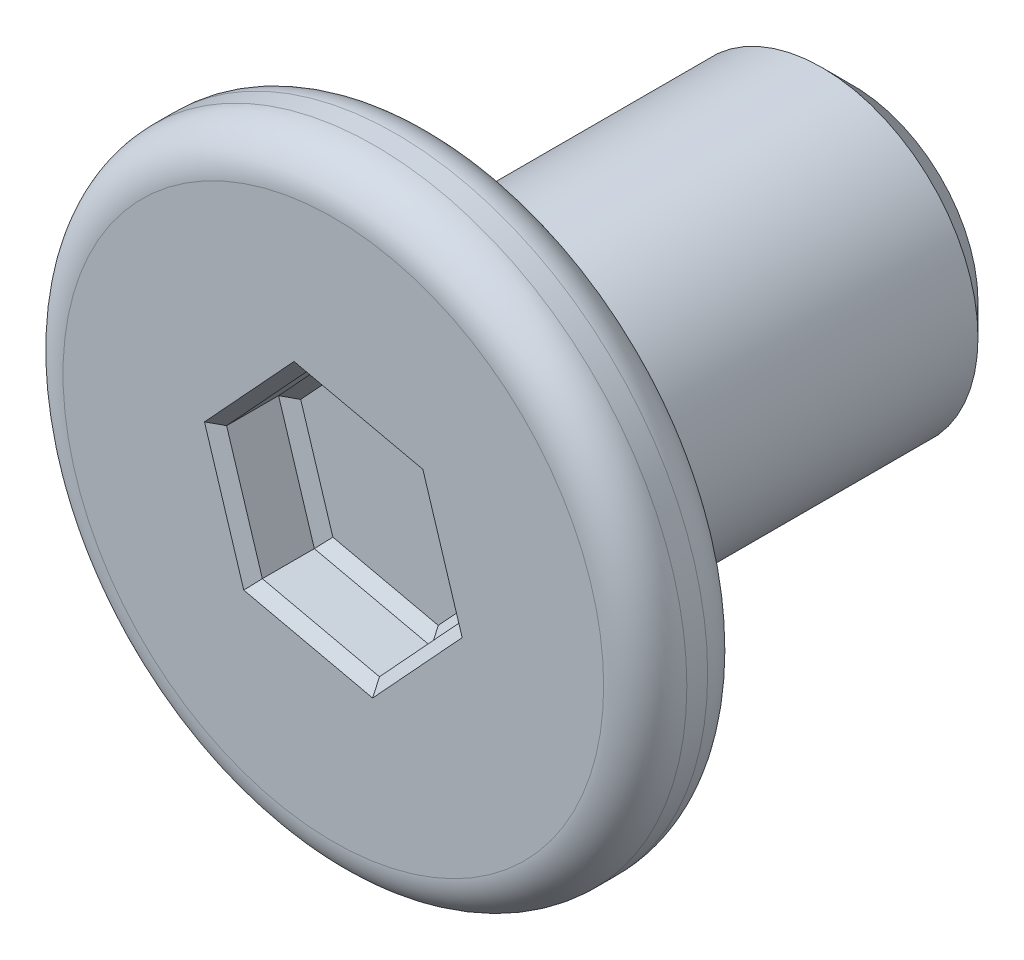
from build123d import *

# Parameters (mm, degrees)
SKETCH_1_R          = 3
EXTRUDE_1_DEPTH     = 1
SKETCH_2_R          = 1.5
EXTRUDE_2_DEPTH     = 4
FILLET_1_R          = 0.4
CUT_EXTRUDE_1_DEPTH = 0.7
CHAMFER_1_SIZE      = 0.1
CHAMFER_2_SIZE      = 0.3


with BuildPart() as part:
    # 草图1 → 凸台-拉伸1 (new body)
    with BuildSketch(Plane.XY):
        Circle(SKETCH_1_R)
    extrude(amount=EXTRUDE_1_DEPTH)

    # 草图2 → 凸台-拉伸2 (add)
    with BuildSketch(Plane(origin=(0, 0, 0), x_dir=(-1, 0, 0), z_dir=(0, 0, -1))):
        Circle(SKETCH_2_R)
    extrude(amount=EXTRUDE_2_DEPTH)

    # 圆角1
    fillet_1_edges = [part.edges().sort_by_distance(p)[0] for p in [
        (-3, 0, 0),
        (-3, 0, 1),
    ]]
    fillet(fillet_1_edges, radius=FILLET_1_R)

    # 草图3 → 切除-拉伸1 (cut)
    with BuildSketch(Plane.XY.offset(1)):
        Polygon((0.343622422, -1.10238694), (1.126506305, -0.253607723), (0.782883884, 0.848779216), (-0.343622422, 1.10238694), (-1.126506305, 0.253607723), (-0.782883884, -0.848779216), align=None)
    extrude(amount=-CUT_EXTRUDE_1_DEPTH, mode=Mode.SUBTRACT)

    # 倒角1
    chamfer_1_edges = [part.edges().sort_by_distance(p)[0] for p in [
        (-0.219630731, -0.975583078, 0.3),
        (-0.954695095, -0.297585747, 0.3),
        (-0.735064364, 0.677997331, 0.3),
        (0.219630731, 0.975583078, 0.3),
        (0.954695095, 0.297585747, 0.3),
        (0.735064364, -0.677997331, 0.3),
        (-0.219630731, -0.975583078, 1),
        (0.735064364, -0.677997331, 1),
        (0.954695095, 0.297585747, 1),
        (0.219630731, 0.975583078, 1),
        (-0.735064364, 0.677997331, 1),
        (-0.954695095, -0.297585747, 1),
    ]]
    chamfer(chamfer_1_edges, length=CHAMFER_1_SIZE)

    # 倒角2
    chamfer_2_edges = [part.edges().sort_by_distance(p)[0] for p in [
        (1.5, 0, -4),
    ]]
    chamfer(chamfer_2_edges, length=CHAMFER_2_SIZE)


solid = part.part
